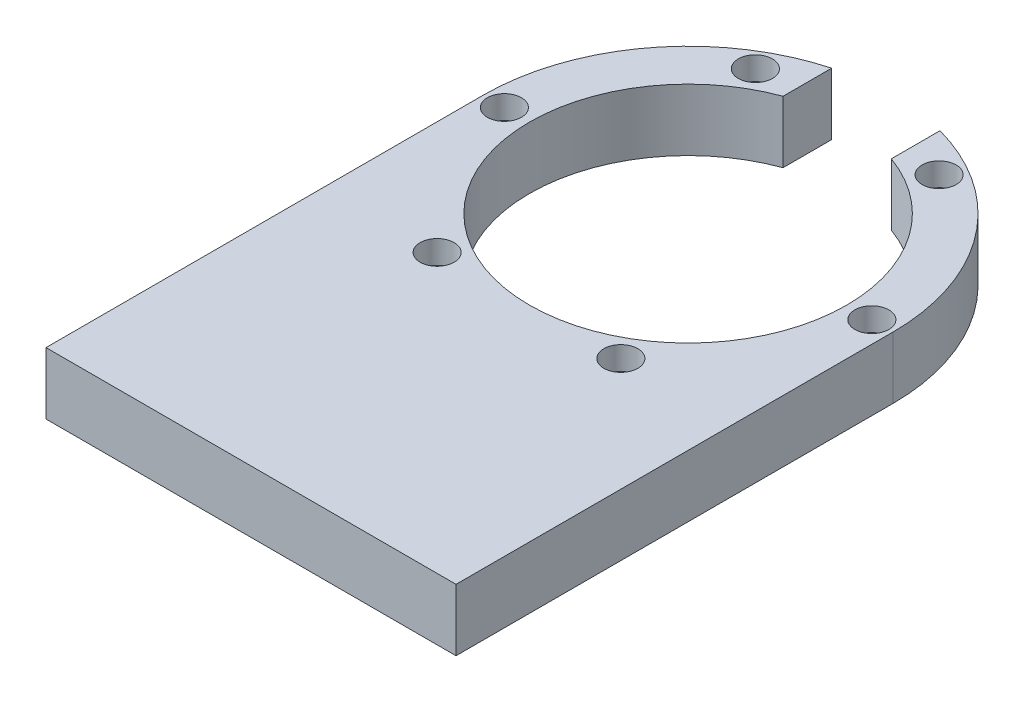
from build123d import *

# Parameters (mm, degrees)
SKETCH1_R           = 26.5
BOSS_EXTRUDE1_DEPTH = 8
SKETCH2_R           = 20.5
CUT_EXTRUDE1_DEPTH  = 8
SKETCH3_W           = 14
SKETCH3_H           = 29.703096534
CUT_EXTRUDE2_DEPTH  = 15
BOSS_EXTRUDE2_START = -8
BOSS_EXTRUDE2_DEPTH = 8
SKETCH5_R           = 1.25
CUT_EXTRUDE3_DEPTH  = 8
SKETCH6_R           = 2.2
CUT_EXTRUDE4_DEPTH  = 3


with BuildPart() as part:
    # Sketch1 → Boss-Extrude1 (new body)
    with BuildSketch(Plane(origin=(0, 0, 0), x_dir=(1, 0, 0), z_dir=(0, 1, 0))):
        with Locations(Location((0, 0, 0), (0, 0, 270))):
            Circle(SKETCH1_R)
    extrude(amount=BOSS_EXTRUDE1_DEPTH)

    # Sketch2 → Cut-Extrude1 (cut)
    with BuildSketch(Plane(origin=(0, 8, 0), x_dir=(1, 0, 0), z_dir=(0, 1, 0))):
        with Locations(Location((0, 0, 0), (0, 0, 270))):
            Circle(SKETCH2_R)
    extrude(amount=-CUT_EXTRUDE1_DEPTH, mode=Mode.SUBTRACT)

    # Sketch3 → Cut-Extrude2 (cut)
    with BuildSketch(Plane(origin=(0, 8, 0), x_dir=(1, 0, 0), z_dir=(0, 1, 0))):
        with Locations((0, 12.871341831)):
            Rectangle(SKETCH3_W, SKETCH3_H)
    extrude(amount=-CUT_EXTRUDE2_DEPTH, mode=Mode.SUBTRACT)

    # Sketch4 → Boss-Extrude2 (add)
    with BuildSketch(Plane(origin=(0, 8, 0), x_dir=(1, 0, 0), z_dir=(0, 1, 0)).offset(BOSS_EXTRUDE2_START)):
        with BuildLine():
            Line((-26.5, 0), (-26.5, -56.5))
            Line((-26.5, -56.5), (26.5, -56.5))
            Line((26.5, -56.5), (26.5, 0))
            ThreePointArc((26.5, 0), (0, -26.5), (-26.5, 0))
        make_face()
    extrude(amount=BOSS_EXTRUDE2_DEPTH)

    # Sketch5 → Cut-Extrude3 (cut)
    with BuildSketch(Plane(origin=(0, 8, 0), x_dir=(1, 0, 0), z_dir=(0, 1, 0))):
        with Locations(Location((23.75, 0, 0), (0, 0, 270))):
            Circle(SKETCH5_R)
        with Locations(Location((11.875, -20.56810334, 0), (0, 0, 270))):
            Circle(SKETCH5_R)
        with Locations(Location((-11.875, -20.56810334, 0), (0, 0, 270))):
            Circle(SKETCH5_R)
        with Locations(Location((-23.75, 0, 0), (0, 0, 270))):
            Circle(SKETCH5_R)
        with Locations(Location((-11.875, 20.56810334, 0), (0, 0, 270))):
            Circle(SKETCH5_R)
        with Locations(Location((11.875, 20.56810334, 0), (0, 0, 270))):
            Circle(SKETCH5_R)
    extrude(amount=-CUT_EXTRUDE3_DEPTH, mode=Mode.SUBTRACT)

    # Sketch6 → Cut-Extrude4 (cut)
    with BuildSketch(Plane(origin=(0, 8, 0), x_dir=(1, 0, 0), z_dir=(0, 1, 0))):
        with Locations(Location((23.75, 0, 0), (0, 0, 270))):
            Circle(SKETCH6_R)
        with Locations(Location((11.875, -20.56810334, 0), (0, 0, 270))):
            Circle(SKETCH6_R)
        with Locations(Location((-11.875, -20.56810334, 0), (0, 0, 270))):
            Circle(SKETCH6_R)
        with Locations(Location((-23.75, 0, 0), (0, 0, 270))):
            Circle(SKETCH6_R)
        with Locations(Location((-11.875, 20.56810334, 0), (0, 0, 270))):
            Circle(SKETCH6_R)
        with Locations(Location((11.875, 20.56810334, 0), (0, 0, 270))):
            Circle(SKETCH6_R)
    extrude(amount=-CUT_EXTRUDE4_DEPTH, mode=Mode.SUBTRACT)


solid = part.part
